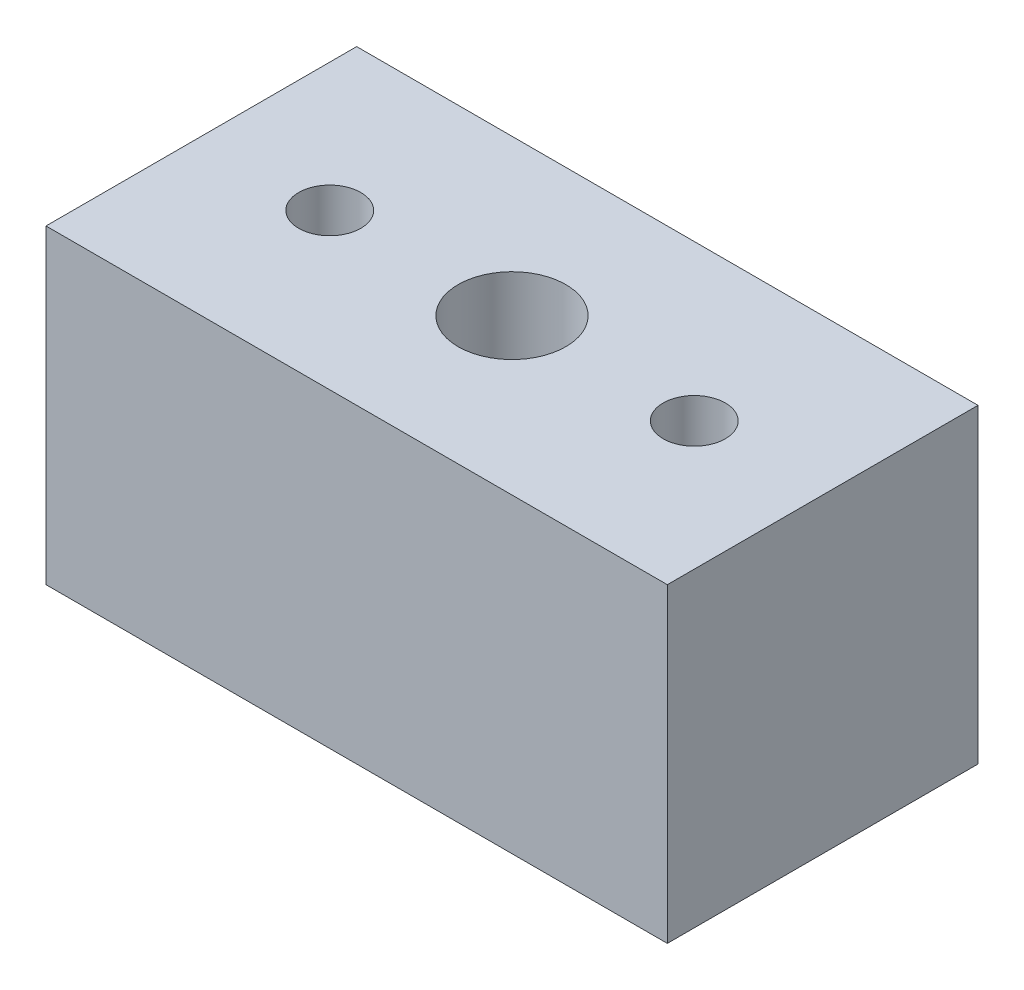
from build123d import *

# Parameters (mm, degrees)
SKETCH1_W           = 30
SKETCH1_H           = 15
BOSS_EXTRUDE1_DEPTH = 15
SKETCH2_R           = 2.6
SKETCH2_R_2         = 1.5
CUT_EXTRUDE1_DEPTH  = 23.5


with BuildPart() as part:
    # Sketch1 → Boss-Extrude1 (new body)
    with BuildSketch(Plane(origin=(0, 0, 0), x_dir=(1, 0, 0), z_dir=(0, 1, 0))):
        Rectangle(SKETCH1_W, SKETCH1_H)
    extrude(amount=BOSS_EXTRUDE1_DEPTH)

    # Sketch2 → Cut-Extrude1 (cut, through all)
    with BuildSketch(Plane(origin=(0, 15, 0), x_dir=(1, 0, 0), z_dir=(0, 1, 0))):
        with Locations(Location((0, 0, 0), (0, 0, 270))):
            Circle(SKETCH2_R)
        with Locations(Location((-8.8, 0, 0), (0, 0, 270))):
            Circle(SKETCH2_R_2)
        with Locations(Location((8.8, 0, 0), (0, 0, 270))):
            Circle(SKETCH2_R_2)
    extrude(amount=-CUT_EXTRUDE1_DEPTH, mode=Mode.SUBTRACT)


solid = part.part
